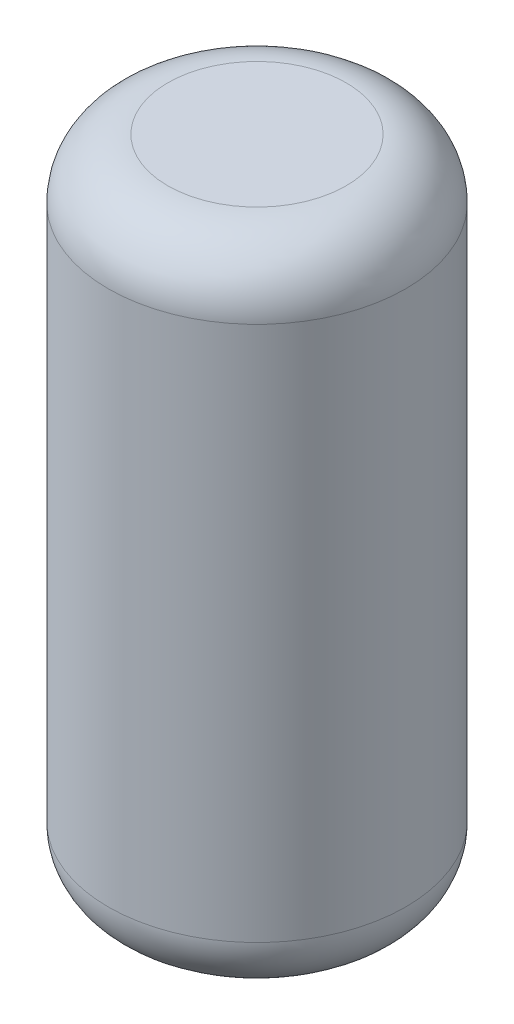
from build123d import *

# Parameters (mm, degrees)
SKETCH1_R           = 2.5
BOSS_EXTRUDE1_DEPTH = 11
FILLET2_R           = 1


with BuildPart() as part:
    # Sketch1 → Boss-Extrude1 (new body)
    with BuildSketch(Plane(origin=(0, 0, 0), x_dir=(1, 0, 0), z_dir=(0, 1, 0))):
        with Locations(Location((0, 0, 0), (0, 0, 270))):
            Circle(SKETCH1_R)
    extrude(amount=BOSS_EXTRUDE1_DEPTH)

    # Fillet2
    fillet2_edges = [part.edges().sort_by_distance(p)[0] for p in [
        (0, 0, -2.5),
        (0, 11, -2.5),
    ]]
    fillet(fillet2_edges, radius=FILLET2_R)


solid = part.part
